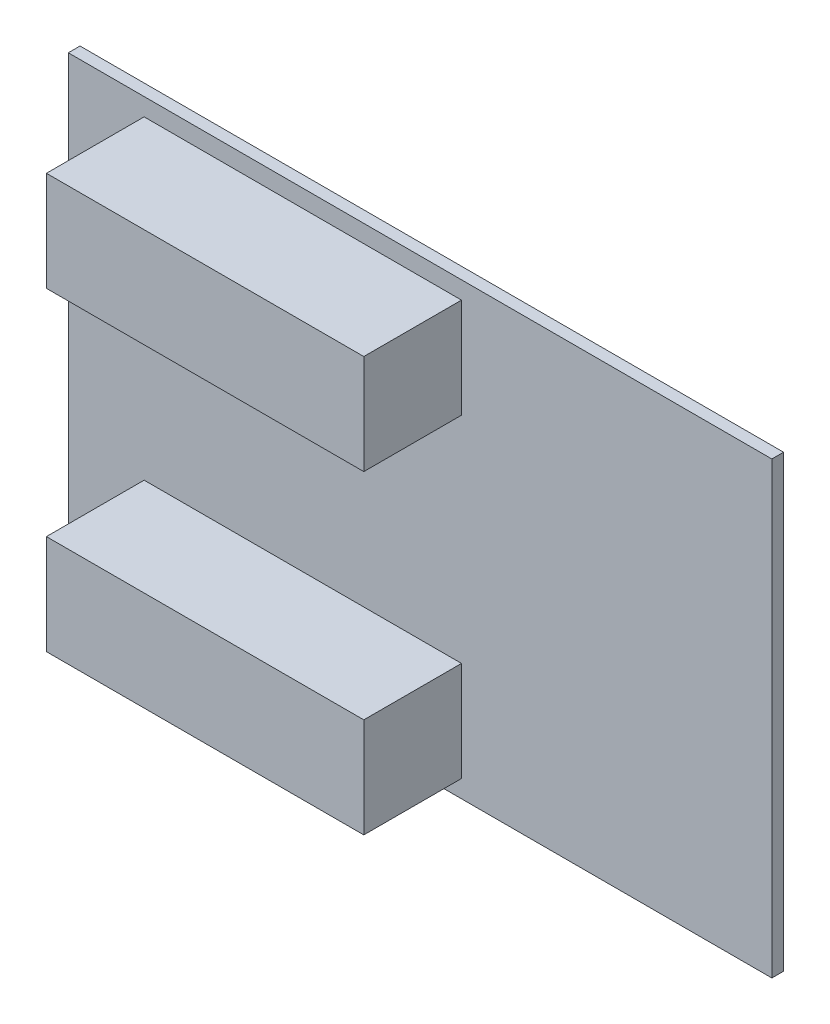
from build123d import *

# Parameters (mm, degrees)
SKETCH_1_W          = 180
SKETCH_1_H          = 115
EXTRUDE_1_DEPTH     = 3
CUT_EXTRUDE_3_REACH = 108.842
SKETCH_7_W          = 76.2
SKETCH_7_H          = 20.5
SKETCH_8_W          = 81.2
SKETCH_8_H          = 25.5
SKETCH_8_W_2        = 76.2
SKETCH_8_H_2        = 20.5
EXTRUDE_2_DEPTH     = 25
SKETCH_9_W          = 81.2
SKETCH_9_H          = 25.5
EXTRUDE_3_DEPTH     = 2.5
CUT_EXTRUDE_START   = -3
SKETCH_4_W          = 4
SKETCH_4_H          = 8
CUT_EXTRUDE_2_DEPTH = 1.6


with BuildPart() as part:
    # 草图1 → 凸台-拉伸1 (new body)
    with BuildSketch(Plane.XY):
        Rectangle(SKETCH_1_W, SKETCH_1_H)
    extrude(amount=EXTRUDE_1_DEPTH)

    # 草图7 → 电池位切除-拉伸3 (cut, up to next)
    with BuildSketch(Plane(origin=(0, 0, 0), x_dir=(-1, 0, 0), z_dir=(0, 0, -1)), mode=Mode.PRIVATE) as cut_extrude_3_sk1:
        with Locations((30, 40.25)):
            Rectangle(SKETCH_7_W, SKETCH_7_H)
    cut_extrude_3_tool1 = extrude(cut_extrude_3_sk1.sketch, amount=-CUT_EXTRUDE_3_REACH, mode=Mode.PRIVATE) & part.part
    cut_extrude_3 = cut_extrude_3_tool1.solids().sort_by_distance((-30, 40.25, 0))[0]
    add(cut_extrude_3, mode=Mode.SUBTRACT)

    # 草图8 → 凸台-拉伸2 (add)
    with BuildSketch(Plane.XY.offset(3)):
        with Locations((-30, 40.25)):
            Rectangle(SKETCH_8_W, SKETCH_8_H)
        with Locations((-30, 40.25)):
            Rectangle(SKETCH_8_W_2, SKETCH_8_H_2, mode=Mode.SUBTRACT)
    extrude_2 = extrude(amount=EXTRUDE_2_DEPTH)

    # 草图9 → 凸台-拉伸3 (add)
    with BuildSketch(Plane.XY.offset(28)):
        with Locations((-30, 40.25)):
            Rectangle(SKETCH_9_W, SKETCH_9_H)
    extrude_3 = extrude(amount=-EXTRUDE_3_DEPTH)

    # 草图4 → 切除-拉伸2 (cut)
    with BuildSketch(Plane(origin=(0, 0, 0), x_dir=(-1, 0, 0), z_dir=(0, 0, -1)).offset(CUT_EXTRUDE_START)):
        with Locations((70.1, 40.25)):
            Rectangle(SKETCH_4_W, SKETCH_4_H)
    cut_extrude_2 = extrude(amount=CUT_EXTRUDE_2_DEPTH, mode=Mode.SUBTRACT)

    # 镜向1: 电池位切除-拉伸3, 凸台-拉伸2, 凸台-拉伸3, 切除-拉伸2 across plane
    add(cut_extrude_3.mirror(Plane.ZX), mode=Mode.SUBTRACT)
    add(extrude_2.mirror(Plane.ZX))
    add(extrude_3.mirror(Plane.ZX))
    add(cut_extrude_2.mirror(Plane.ZX), mode=Mode.SUBTRACT)


solid = part.part
